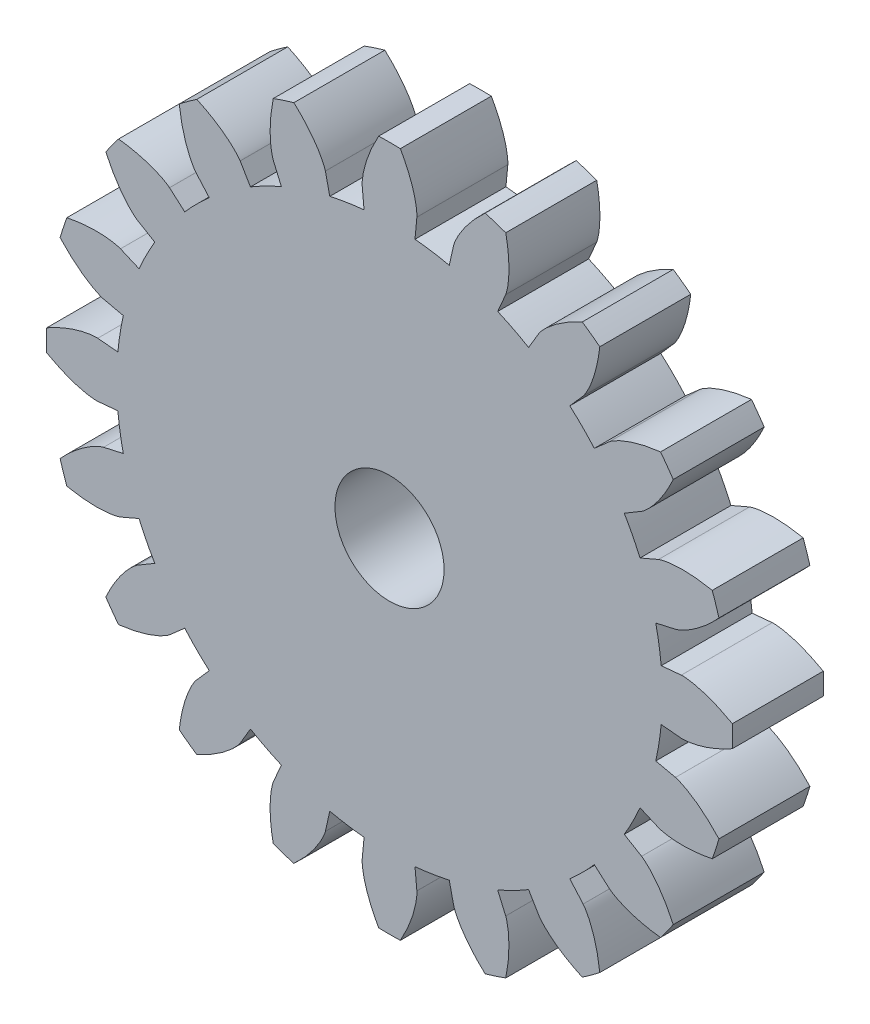
from build123d import *

# Parameters (mm, degrees)
BOSS_EXTRU_2_DEPTH      = 5
ESQUISSE5_R             = 3
ENL_V_MAT_EXTRU_1_DEPTH = 10


with BuildPart() as part:
    # Esquisse1 → Boss.-Extru.2 (new body)
    with BuildSketch(Plane.XY):
        with BuildLine():
            Line((15.061833018, -1.986598839), (16.166011031, -2.090079236))
            Line((16.166011031, -2.090079236), (16.167248729, -2.090184901))
            add(Edge.make_bspline(
                [(16.167248729, -2.090184901), (16.168010276, -2.090249591), (16.16950691, -2.090364207), (16.172217338, -2.090553644), (16.178108132, -2.090926243), (16.187803431, -2.091391834), (16.199588241, -2.091824401), (16.216075089, -2.092197747), (16.238348708, -2.092357298), (16.264570049, -2.09214555), (16.297766888, -2.091321508), (16.338641823, -2.089563323), (16.387967798, -2.086519176), (16.44653889, -2.081697831), (16.515028916, -2.074614628), (16.596049791, -2.064386014), (16.688524926, -2.05049604), (16.792857716, -2.032230542), (16.909645655, -2.008748342), (17.039170881, -1.979218799), (17.181775487, -1.942793825), (17.337755344, -1.898425888), (17.507314461, -1.845165066), (17.690589139, -1.781851971), (17.887635249, -1.707448887), (18.10712261, -1.617253369), (18.313769022, -1.524760348), (18.502569592, -1.434047819), (18.672140134, -1.347703339), (18.805881791, -1.276374918), (18.88088835, -1.235285986), (18.93417944, -1.205541045), (18.965584627, -1.187822628), (18.975011328, -1.182487176)],
                knots=[0, 0, 0, 0, 0, 0, 0.016666667, 0.025, 0.033333333, 0.054166667, 0.066666667, 0.083333333, 0.104166667, 0.125, 0.15, 0.175, 0.204166667, 0.2375, 0.270833333, 0.308333333, 0.35, 0.391666667, 0.4375, 0.483333333, 0.533333333, 0.5875, 0.641666667, 0.7, 0.758333333, 0.820833333, 0.9, 0.929166667, 0.958333333, 0.9875, 1, 1, 1, 1, 1, 1], degree=5, weights=[1, 1, 1, 1, 1, 1, 1, 1, 1, 1, 1, 1, 1, 1, 1, 1, 1, 1, 1, 1, 1, 1, 1, 1, 1, 1, 1, 1, 1, 1, 1, 1, 1, 1]))
            ThreePointArc((18.975011328, -1.182487176), (18.984416875, -0.58697479), (18.975011328, 0.008537596))
            add(Edge.make_bspline(
                [(18.975011328, 0.008537596), (18.915308885, 0.04232879), (18.837024614, 0.085739213), (18.734147438, 0.141213329), (18.594872445, 0.213559753), (18.423447438, 0.297985253), (18.278042022, 0.366393905), (18.113606417, 0.439634655), (17.937293773, 0.513256644), (17.761576686, 0.581605269), (17.581647157, 0.64623739), (17.396064457, 0.706993037), (17.21186886, 0.761159393), (17.030683095, 0.80807461), (16.833258221, 0.851875904), (16.649127604, 0.884407781), (16.493857536, 0.904487194), (16.36422671, 0.915220787), (16.275539883, 0.918408583), (16.228486641, 0.918530553), (16.201487473, 0.917959405), (16.185304316, 0.917327269), (16.177142959, 0.916919138), (16.17214071, 0.916599752), (16.169227945, 0.916394059), (16.167819889, 0.916283838), (16.167248729, 0.916235321)],
                knots=[-1, -1, -1, -1, -1, -1, -0.920833333, -0.895833333, -0.8625, -0.8125, -0.766666667, -0.720833333, -0.666666667, -0.6125, -0.558333333, -0.5, -0.4375, -0.375, -0.3125, -0.2125, -0.15, -0.108333333, -0.058333333, -0.045833333, -0.0375, -0.025, -0.0125, 0, 0, 0, 0, 0, 0], degree=5, weights=[1, 1, 1, 1, 1, 1, 1, 1, 1, 1, 1, 1, 1, 1, 1, 1, 1, 1, 1, 1, 1, 1, 1, 1, 1, 1, 1]))
            Line((16.167248729, 0.916235321), (16.166011031, 0.916129657))
            Line((16.166011031, 0.916129657), (15.061833018, 0.812649259))
            ThreePointArc((15.061833018, 0.812649259), (14.942599127, 1.759542186), (14.763391289, 2.696936172))
            Line((14.763391289, 2.696936172), (15.845504186, 2.939730237))
            Line((15.845504186, 2.939730237), (15.846713959, 2.940012214))
            add(Edge.make_bspline(
                [(15.846713959, 2.940012214), (15.847458223, 2.940186021), (15.848917025, 2.9405395), (15.851553334, 2.941196903), (15.857270952, 2.942662896), (15.866635605, 2.945216104), (15.877977295, 2.948446415), (15.89377259, 2.953186059), (15.915005364, 2.959917243), (15.939877908, 2.968221467), (15.971195335, 2.979263566), (16.009526399, 2.993566748), (16.055497496, 3.011704469), (16.109712037, 3.034389303), (16.172661093, 3.062290412), (16.246555708, 3.097055229), (16.33021255, 3.138841767), (16.423794581, 3.188453893), (16.527610112, 3.246876251), (16.641670792, 3.31498601), (16.766039895, 3.393695466), (16.900675109, 3.484092309), (17.045476912, 3.587143009), (17.200216667, 3.703992331), (17.364626837, 3.835644465), (17.545499774, 3.989250825), (17.713450274, 4.141074169), (17.864978574, 4.285689495), (17.999567832, 4.420208154), (18.104722011, 4.529373959), (18.16336031, 4.591630157), (18.204851456, 4.63638713), (18.229244271, 4.662943082), (18.236560852, 4.670930409)],
                knots=[0, 0, 0, 0, 0, 0, 0.016666667, 0.025, 0.033333333, 0.054166667, 0.066666667, 0.083333333, 0.104166667, 0.125, 0.15, 0.175, 0.204166667, 0.2375, 0.270833333, 0.308333333, 0.35, 0.391666667, 0.4375, 0.483333333, 0.533333333, 0.5875, 0.641666667, 0.7, 0.758333333, 0.820833333, 0.9, 0.929166667, 0.958333333, 0.9875, 1, 1, 1, 1, 1, 1], degree=5, weights=[1, 1, 1, 1, 1, 1, 1, 1, 1, 1, 1, 1, 1, 1, 1, 1, 1, 1, 1, 1, 1, 1, 1, 1, 1, 1, 1, 1, 1, 1, 1, 1, 1, 1]))
            ThreePointArc((18.236560852, 4.670930409), (18.061482611, 5.240202818), (17.868513957, 5.80366228))
            add(Edge.make_bspline(
                [(17.868513957, 5.80366228), (17.801291506, 5.817350545), (17.713424181, 5.83444514), (17.598439728, 5.855413365), (17.443625064, 5.881180563), (17.25450128, 5.908500745), (17.095073076, 5.928628494), (16.916052885, 5.94747119), (16.72561915, 5.963006259), (16.537381384, 5.973710098), (16.346285809, 5.979577616), (16.151011645, 5.980011462), (15.959092897, 5.974607158), (15.772277395, 5.9632367), (15.570979838, 5.943886565), (15.385808313, 5.917926729), (15.231932823, 5.889042296), (15.105329718, 5.859192421), (15.01999845, 5.834818459), (14.975210468, 5.820394208), (14.949709227, 5.811507812), (14.934513471, 5.805905744), (14.926877679, 5.802995591), (14.922218953, 5.801146056), (14.919512311, 5.800050337), (14.918207231, 5.799510397), (14.917679018, 5.799287757)],
                knots=[-1, -1, -1, -1, -1, -1, -0.920833333, -0.895833333, -0.8625, -0.8125, -0.766666667, -0.720833333, -0.666666667, -0.6125, -0.558333333, -0.5, -0.4375, -0.375, -0.3125, -0.2125, -0.15, -0.108333333, -0.058333333, -0.045833333, -0.0375, -0.025, -0.0125, 0, 0, 0, 0, 0, 0], degree=5, weights=[1, 1, 1, 1, 1, 1, 1, 1, 1, 1, 1, 1, 1, 1, 1, 1, 1, 1, 1, 1, 1, 1, 1, 1, 1, 1, 1]))
            Line((14.917679018, 5.799287757), (14.916534549, 5.798804794))
            Line((14.916534549, 5.798804794), (13.898376056, 5.359179317))
            ThreePointArc((13.898376056, 5.359179317), (13.492371881, 6.222882706), (13.032264427, 7.059019098))
            Line((13.032264427, 7.059019098), (13.986387456, 7.624321251))
            Line((13.986387456, 7.624321251), (13.987450883, 7.624963267))
            add(Edge.make_bspline(
                [(13.987450883, 7.624963267), (13.988105011, 7.625358558), (13.989383183, 7.626145531), (13.991687314, 7.627585422), (13.996672075, 7.630746506), (14.004789403, 7.636068588), (14.014577771, 7.642645571), (14.028135359, 7.652034254), (14.046248877, 7.664997279), (14.067337926, 7.680581105), (14.093710372, 7.700760382), (14.125745454, 7.726208467), (14.163861701, 7.757664314), (14.208412795, 7.795992088), (14.259658988, 7.841979947), (14.319194024, 7.897877945), (14.385843658, 7.963470691), (14.459514468, 8.039573064), (14.540195404, 8.127216792), (14.627626484, 8.227239711), (14.721585971, 8.340529018), (14.821697507, 8.468106093), (14.927567788, 8.610859351), (15.038625614, 8.769806874), (15.15430623, 8.945821031), (15.27885964, 9.147802172), (15.391674065, 9.344094311), (15.491097448, 9.528456479), (15.577530887, 9.697981694), (15.643804366, 9.834298973), (15.680334478, 9.911628367), (15.705964238, 9.967016246), (15.720956944, 9.999810253), (15.725447206, 10.0096676)],
                knots=[0, 0, 0, 0, 0, 0, 0.016666667, 0.025, 0.033333333, 0.054166667, 0.066666667, 0.083333333, 0.104166667, 0.125, 0.15, 0.175, 0.204166667, 0.2375, 0.270833333, 0.308333333, 0.35, 0.391666667, 0.4375, 0.483333333, 0.533333333, 0.5875, 0.641666667, 0.7, 0.758333333, 0.820833333, 0.9, 0.929166667, 0.958333333, 0.9875, 1, 1, 1, 1, 1, 1], degree=5, weights=[1, 1, 1, 1, 1, 1, 1, 1, 1, 1, 1, 1, 1, 1, 1, 1, 1, 1, 1, 1, 1, 1, 1, 1, 1, 1, 1, 1, 1, 1, 1, 1, 1, 1]))
            ThreePointArc((15.725447206, 10.0096676), (15.383023054, 10.496975682), (15.02538041, 10.973226881))
            add(Edge.make_bspline(
                [(15.02538041, 10.973226881), (14.957218153, 10.965472315), (14.868368841, 10.954577745), (14.75253259, 10.938987561), (14.597332593, 10.915653261), (14.409022785, 10.883193834), (14.251177736, 10.853070437), (14.075096704, 10.815670625), (13.889182858, 10.771598093), (13.706850436, 10.72360938), (13.523294581, 10.670137941), (13.33744375, 10.610207517), (13.156588196, 10.545761565), (12.98242976, 10.477218452), (12.796963927, 10.396611014), (12.628877372, 10.314700594), (12.491458866, 10.239679724), (12.380276276, 10.172168295), (12.306653387, 10.122618468), (12.268514822, 10.095059942), (12.247007749, 10.078728161), (12.23428686, 10.068704531), (12.227924077, 10.063577221), (12.224064903, 10.060378583), (12.221829329, 10.058500094), (12.220754975, 10.057583289), (12.220321415, 10.057208318)],
                knots=[-1, -1, -1, -1, -1, -1, -0.920833333, -0.895833333, -0.8625, -0.8125, -0.766666667, -0.720833333, -0.666666667, -0.6125, -0.558333333, -0.5, -0.4375, -0.375, -0.3125, -0.2125, -0.15, -0.108333333, -0.058333333, -0.045833333, -0.0375, -0.025, -0.0125, 0, 0, 0, 0, 0, 0], degree=5, weights=[1, 1, 1, 1, 1, 1, 1, 1, 1, 1, 1, 1, 1, 1, 1, 1, 1, 1, 1, 1, 1, 1, 1, 1, 1, 1, 1]))
            Line((12.220321415, 10.057208318), (12.219382204, 10.056395334))
            Line((12.219382204, 10.056395334), (11.386907677, 9.323658381))
            ThreePointArc((11.386907677, 9.323658381), (10.733875736, 10.019626928), (10.037907189, 10.67265887))
            Line((10.037907189, 10.67265887), (10.770644141, 11.505133396))
            Line((10.770644141, 11.505133396), (10.771457126, 11.506072607))
            add(Edge.make_bspline(
                [(10.771457126, 11.506072607), (10.771957087, 11.506650687), (10.772929513, 11.50779412), (10.774675921, 11.509875553), (10.778439882, 11.514422299), (10.784515306, 11.521992292), (10.791792197, 11.531272147), (10.801784967, 11.54439084), (10.815006151, 11.562316795), (10.830247362, 11.583654768), (10.849093309, 11.610995935), (10.871696592, 11.645097887), (10.898226906, 11.686792743), (10.92875358, 11.737011667), (10.963280576, 11.796584665), (11.002628329, 11.868144158), (11.045746624, 11.951122436), (11.092294802, 12.046265627), (11.14194353, 12.154551545), (11.194186646, 12.276696683), (11.248539107, 12.413476296), (11.304327352, 12.56574547), (11.36090279, 12.734227603), (11.417407573, 12.919714436), (11.473035012, 13.122861123), (11.529076738, 13.353445723), (11.575712025, 13.574992216), (11.613298239, 13.781054572), (11.643115151, 13.968992034), (11.66402062, 14.119117101), (11.674866725, 14.203950151), (11.682126279, 14.264547186), (11.686251284, 14.30036914), (11.687475689, 14.311131602)],
                knots=[0, 0, 0, 0, 0, 0, 0.016666667, 0.025, 0.033333333, 0.054166667, 0.066666667, 0.083333333, 0.104166667, 0.125, 0.15, 0.175, 0.204166667, 0.2375, 0.270833333, 0.308333333, 0.35, 0.391666667, 0.4375, 0.483333333, 0.533333333, 0.5875, 0.641666667, 0.7, 0.758333333, 0.820833333, 0.9, 0.929166667, 0.958333333, 0.9875, 1, 1, 1, 1, 1, 1], degree=5, weights=[1, 1, 1, 1, 1, 1, 1, 1, 1, 1, 1, 1, 1, 1, 1, 1, 1, 1, 1, 1, 1, 1, 1, 1, 1, 1, 1, 1, 1, 1, 1, 1, 1, 1]))
            ThreePointArc((11.687475689, 14.311131602), (11.21122449, 14.668774247), (10.723916407, 15.011198398))
            add(Edge.make_bspline(
                [(10.723916407, 15.011198398), (10.661486541, 14.982760072), (10.580352432, 14.944942772), (10.475003242, 14.894320256), (10.334609969, 14.824168582), (10.165547213, 14.735106902), (10.024736293, 14.657681045), (9.868830457, 14.567699679), (9.705635045, 14.468333673), (9.547055934, 14.366349878), (9.389007526, 14.258773639), (9.230772401, 14.144345353), (9.078683443, 14.02716617), (8.934229914, 13.90815988), (8.782750493, 13.774185556), (8.648202391, 13.644342516), (8.540692349, 13.530528775), (8.455813602, 13.431964281), (8.401105811, 13.362088871), (8.373349934, 13.324093691), (8.35794229, 13.301915192), (8.348941477, 13.288451183), (8.344474537, 13.281608613), (8.341792678, 13.277373978), (8.340247006, 13.274896598), (8.339508543, 13.273692671), (8.339212075, 13.273202075)],
                knots=[-1, -1, -1, -1, -1, -1, -0.920833333, -0.895833333, -0.8625, -0.8125, -0.766666667, -0.720833333, -0.666666667, -0.6125, -0.558333333, -0.5, -0.4375, -0.375, -0.3125, -0.2125, -0.15, -0.108333333, -0.058333333, -0.045833333, -0.0375, -0.025, -0.0125, 0, 0, 0, 0, 0, 0], degree=5, weights=[1, 1, 1, 1, 1, 1, 1, 1, 1, 1, 1, 1, 1, 1, 1, 1, 1, 1, 1, 1, 1, 1, 1, 1, 1, 1, 1]))
            Line((8.339212075, 13.273202075), (8.338570058, 13.272138649))
            Line((8.338570058, 13.272138649), (7.773267906, 12.318015619))
            ThreePointArc((7.773267906, 12.318015619), (6.937131514, 12.778123073), (6.073428124, 13.184127248))
            Line((6.073428124, 13.184127248), (6.513053602, 14.202285742))
            Line((6.513053602, 14.202285742), (6.513536564, 14.203430211))
            add(Edge.make_bspline(
                [(6.513536564, 14.203430211), (6.513833419, 14.204134494), (6.51440491, 14.205522459), (6.515422645, 14.20804169), (6.517597363, 14.213529029), (6.521036178, 14.22260593), (6.52508928, 14.23368028), (6.53053907, 14.249244834), (6.537573738, 14.270379), (6.545475194, 14.295382412), (6.554949871, 14.327209125), (6.565908787, 14.366626807), (6.578256196, 14.41447929), (6.591770287, 14.471673586), (6.606198343, 14.539000303), (6.62150718, 14.619216549), (6.636873418, 14.711457867), (6.651742503, 14.816328596), (6.665499061, 14.934656925), (6.677440293, 15.066967866), (6.686865331, 15.213848841), (6.692869342, 15.375904948), (6.694611939, 15.55362375), (6.691032597, 15.747493149), (6.681161656, 15.957886953), (6.663205945, 16.194503786), (6.639097108, 16.419618118), (6.611166951, 16.627209843), (6.58144865, 16.815162924), (6.554939735, 16.964400492), (6.53904014, 17.048433148), (6.527218872, 17.108307679), (6.520072392, 17.143651078), (6.517911087, 17.154265149)],
                knots=[0, 0, 0, 0, 0, 0, 0.016666667, 0.025, 0.033333333, 0.054166667, 0.066666667, 0.083333333, 0.104166667, 0.125, 0.15, 0.175, 0.204166667, 0.2375, 0.270833333, 0.308333333, 0.35, 0.391666667, 0.4375, 0.483333333, 0.533333333, 0.5875, 0.641666667, 0.7, 0.758333333, 0.820833333, 0.9, 0.929166667, 0.958333333, 0.9875, 1, 1, 1, 1, 1, 1], degree=5, weights=[1, 1, 1, 1, 1, 1, 1, 1, 1, 1, 1, 1, 1, 1, 1, 1, 1, 1, 1, 1, 1, 1, 1, 1, 1, 1, 1, 1, 1, 1, 1, 1, 1, 1]))
            ThreePointArc((6.517911087, 17.154265149), (5.954451626, 17.347233803), (5.385179217, 17.522312044))
            add(Edge.make_bspline(
                [(5.385179217, 17.522312044), (5.334592812, 17.4759737), (5.269115877, 17.414935492), (5.184566061, 17.334235928), (5.072722184, 17.224133813), (4.939455521, 17.087187858), (4.829462283, 16.970038525), (4.708992793, 16.836283608), (4.584490517, 16.691350764), (4.465187547, 16.545354771), (4.348117464, 16.394204044), (4.232987202, 16.236478934), (4.124552366, 16.078036836), (4.023943863, 15.920216533), (3.921278716, 15.745989664), (3.833439572, 15.580923945), (3.766361826, 15.439458214), (3.716095444, 15.319488835), (3.685657933, 15.236127734), (3.671001682, 15.191415132), (3.663201674, 15.165560903), (3.658802, 15.149974465), (3.656668158, 15.142086434), (3.655426133, 15.137230316), (3.654721664, 15.134396549), (3.654391377, 15.133023349), (3.654261022, 15.132465151)],
                knots=[-1, -1, -1, -1, -1, -1, -0.920833333, -0.895833333, -0.8625, -0.8125, -0.766666667, -0.720833333, -0.666666667, -0.6125, -0.558333333, -0.5, -0.4375, -0.375, -0.3125, -0.2125, -0.15, -0.108333333, -0.058333333, -0.045833333, -0.0375, -0.025, -0.0125, 0, 0, 0, 0, 0, 0], degree=5, weights=[1, 1, 1, 1, 1, 1, 1, 1, 1, 1, 1, 1, 1, 1, 1, 1, 1, 1, 1, 1, 1, 1, 1, 1, 1, 1, 1]))
            Line((3.654261022, 15.132465151), (3.653979045, 15.131255378))
            Line((3.653979045, 15.131255378), (3.41118498, 14.049142482))
            ThreePointArc((3.41118498, 14.049142482), (2.473790993, 14.228350319), (1.526898067, 14.34758421))
            Line((1.526898067, 14.34758421), (1.630378464, 15.451762224))
            Line((1.630378464, 15.451762224), (1.630484128, 15.452999922))
            add(Edge.make_bspline(
                [(1.630484128, 15.452999922), (1.630548818, 15.453761468), (1.630663434, 15.455258102), (1.630852872, 15.45796853), (1.631225471, 15.463859325), (1.631691062, 15.473554623), (1.632123629, 15.485339433), (1.632496975, 15.501826281), (1.632656526, 15.5240999), (1.632444778, 15.550321242), (1.631620735, 15.583518081), (1.629862551, 15.624393015), (1.626818404, 15.67371899), (1.621997059, 15.732290082), (1.614913856, 15.800780109), (1.604685242, 15.881800984), (1.590795268, 15.974276119), (1.57252977, 16.078608909), (1.549047569, 16.195396848), (1.519518027, 16.324922073), (1.483093053, 16.467526679), (1.438725116, 16.623506537), (1.385464294, 16.793065653), (1.322151199, 16.976340331), (1.247748115, 17.173386442), (1.157552597, 17.392873803), (1.065059575, 17.599520214), (0.974347047, 17.788320784), (0.888002567, 17.957891327), (0.816674146, 18.091632983), (0.775585214, 18.166639542), (0.745840273, 18.219930633), (0.728121855, 18.251335819), (0.722786404, 18.260762521)],
                knots=[0, 0, 0, 0, 0, 0, 0.016666667, 0.025, 0.033333333, 0.054166667, 0.066666667, 0.083333333, 0.104166667, 0.125, 0.15, 0.175, 0.204166667, 0.2375, 0.270833333, 0.308333333, 0.35, 0.391666667, 0.4375, 0.483333333, 0.533333333, 0.5875, 0.641666667, 0.7, 0.758333333, 0.820833333, 0.9, 0.929166667, 0.958333333, 0.9875, 1, 1, 1, 1, 1, 1], degree=5, weights=[1, 1, 1, 1, 1, 1, 1, 1, 1, 1, 1, 1, 1, 1, 1, 1, 1, 1, 1, 1, 1, 1, 1, 1, 1, 1, 1, 1, 1, 1, 1, 1, 1, 1]))
            ThreePointArc((0.722786404, 18.260762521), (0.127274018, 18.270168067), (-0.468238368, 18.260762521))
            add(Edge.make_bspline(
                [(-0.468238368, 18.260762521), (-0.502029562, 18.201060077), (-0.545439985, 18.122775806), (-0.600914101, 18.01989863), (-0.673260525, 17.880623638), (-0.757686026, 17.70919863), (-0.826094677, 17.563793215), (-0.899335427, 17.39935761), (-0.972957416, 17.223044965), (-1.041306041, 17.047327879), (-1.105938162, 16.86739835), (-1.166693809, 16.681815649), (-1.220860165, 16.497620052), (-1.267775382, 16.316434287), (-1.311576676, 16.119009413), (-1.344108554, 15.934878797), (-1.364187966, 15.779608728), (-1.374921559, 15.649977902), (-1.378109356, 15.561291075), (-1.378231325, 15.514237834), (-1.377660177, 15.487238666), (-1.377028041, 15.471055508), (-1.376619911, 15.462894152), (-1.376300524, 15.457891902), (-1.376094831, 15.454979137), (-1.37598461, 15.453571082), (-1.375936093, 15.452999922)],
                knots=[-1, -1, -1, -1, -1, -1, -0.920833333, -0.895833333, -0.8625, -0.8125, -0.766666667, -0.720833333, -0.666666667, -0.6125, -0.558333333, -0.5, -0.4375, -0.375, -0.3125, -0.2125, -0.15, -0.108333333, -0.058333333, -0.045833333, -0.0375, -0.025, -0.0125, 0, 0, 0, 0, 0, 0], degree=5, weights=[1, 1, 1, 1, 1, 1, 1, 1, 1, 1, 1, 1, 1, 1, 1, 1, 1, 1, 1, 1, 1, 1, 1, 1, 1, 1, 1]))
            Line((-1.375936093, 15.452999922), (-1.375830429, 15.451762224))
            Line((-1.375830429, 15.451762224), (-1.272350031, 14.34758421))
            ThreePointArc((-1.272350031, 14.34758421), (-2.219242958, 14.228350319), (-3.156636945, 14.049142482))
            Line((-3.156636945, 14.049142482), (-3.399431009, 15.131255378))
            Line((-3.399431009, 15.131255378), (-3.399712986, 15.132465151))
            add(Edge.make_bspline(
                [(-3.399712986, 15.132465151), (-3.399886793, 15.133209415), (-3.400240272, 15.134668217), (-3.400897675, 15.137304526), (-3.402363668, 15.143022145), (-3.404916877, 15.152386797), (-3.408147188, 15.163728488), (-3.412886831, 15.179523782), (-3.419618015, 15.200756556), (-3.42792224, 15.225629101), (-3.438964338, 15.256946527), (-3.45326752, 15.295277592), (-3.471405241, 15.341248688), (-3.494090075, 15.395463229), (-3.521991184, 15.458412285), (-3.556756001, 15.532306901), (-3.59854254, 15.615963743), (-3.648154665, 15.709545773), (-3.706577023, 15.813361305), (-3.774686783, 15.927421984), (-3.853396239, 16.051791088), (-3.943793081, 16.186426301), (-4.046843781, 16.331228105), (-4.163693103, 16.485967859), (-4.295345237, 16.650378029), (-4.448951597, 16.831250966), (-4.600774941, 16.999201466), (-4.745390267, 17.150729766), (-4.879908927, 17.285319024), (-4.989074731, 17.390473204), (-5.051330929, 17.449111502), (-5.096087902, 17.490602649), (-5.122643855, 17.514995464), (-5.130631182, 17.522312044)],
                knots=[0, 0, 0, 0, 0, 0, 0.016666667, 0.025, 0.033333333, 0.054166667, 0.066666667, 0.083333333, 0.104166667, 0.125, 0.15, 0.175, 0.204166667, 0.2375, 0.270833333, 0.308333333, 0.35, 0.391666667, 0.4375, 0.483333333, 0.533333333, 0.5875, 0.641666667, 0.7, 0.758333333, 0.820833333, 0.9, 0.929166667, 0.958333333, 0.9875, 1, 1, 1, 1, 1, 1], degree=5, weights=[1, 1, 1, 1, 1, 1, 1, 1, 1, 1, 1, 1, 1, 1, 1, 1, 1, 1, 1, 1, 1, 1, 1, 1, 1, 1, 1, 1, 1, 1, 1, 1, 1, 1]))
            ThreePointArc((-5.130631182, 17.522312044), (-5.69990359, 17.347233803), (-6.263363052, 17.154265149))
            add(Edge.make_bspline(
                [(-6.263363052, 17.154265149), (-6.277051318, 17.087042698), (-6.294145913, 16.999175373), (-6.315114137, 16.88419092), (-6.340881335, 16.729376257), (-6.368201517, 16.540252472), (-6.388329266, 16.380824268), (-6.407171963, 16.201804078), (-6.422707031, 16.011370342), (-6.433410871, 15.823132576), (-6.439278388, 15.632037001), (-6.439712234, 15.436762837), (-6.43430793, 15.24484409), (-6.422937472, 15.058028588), (-6.403587337, 14.856731031), (-6.377627502, 14.671559505), (-6.348743068, 14.517684015), (-6.318893193, 14.39108091), (-6.294519231, 14.305749643), (-6.28009498, 14.26096166), (-6.271208584, 14.23546042), (-6.265606516, 14.220264663), (-6.262696363, 14.212628871), (-6.260846828, 14.207970145), (-6.259751109, 14.205263503), (-6.25921117, 14.203958423), (-6.258988529, 14.203430211)],
                knots=[-1, -1, -1, -1, -1, -1, -0.920833333, -0.895833333, -0.8625, -0.8125, -0.766666667, -0.720833333, -0.666666667, -0.6125, -0.558333333, -0.5, -0.4375, -0.375, -0.3125, -0.2125, -0.15, -0.108333333, -0.058333333, -0.045833333, -0.0375, -0.025, -0.0125, 0, 0, 0, 0, 0, 0], degree=5, weights=[1, 1, 1, 1, 1, 1, 1, 1, 1, 1, 1, 1, 1, 1, 1, 1, 1, 1, 1, 1, 1, 1, 1, 1, 1, 1, 1]))
            Line((-6.258988529, 14.203430211), (-6.258505566, 14.202285742))
            Line((-6.258505566, 14.202285742), (-5.818880089, 13.184127248))
            ThreePointArc((-5.818880089, 13.184127248), (-6.682583478, 12.778123073), (-7.518719871, 12.318015619))
            Line((-7.518719871, 12.318015619), (-8.084022023, 13.272138649))
            Line((-8.084022023, 13.272138649), (-8.084664039, 13.273202075))
            add(Edge.make_bspline(
                [(-8.084664039, 13.273202075), (-8.08505933, 13.273856203), (-8.085846303, 13.275134375), (-8.087286194, 13.277438506), (-8.090447278, 13.282423267), (-8.09576936, 13.290540596), (-8.102346344, 13.300328964), (-8.111735027, 13.313886551), (-8.124698052, 13.332000069), (-8.140281877, 13.353089118), (-8.160461154, 13.379461565), (-8.185909239, 13.411496647), (-8.217365086, 13.449612894), (-8.25569286, 13.494163987), (-8.301680719, 13.54541018), (-8.357578717, 13.604945216), (-8.423171463, 13.671594851), (-8.499273836, 13.745265661), (-8.586917564, 13.825946597), (-8.686940483, 13.913377676), (-8.80022979, 14.007337163), (-8.927806865, 14.107448699), (-9.070560123, 14.213318981), (-9.229507646, 14.324376806), (-9.405521803, 14.440057423), (-9.607502944, 14.564610832), (-9.803795083, 14.677425257), (-9.988157251, 14.776848641), (-10.157682467, 14.863282079), (-10.293999745, 14.929555558), (-10.371329139, 14.966085671), (-10.426717018, 14.991715431), (-10.459511025, 15.006708136), (-10.469368372, 15.011198398)],
                knots=[0, 0, 0, 0, 0, 0, 0.016666667, 0.025, 0.033333333, 0.054166667, 0.066666667, 0.083333333, 0.104166667, 0.125, 0.15, 0.175, 0.204166667, 0.2375, 0.270833333, 0.308333333, 0.35, 0.391666667, 0.4375, 0.483333333, 0.533333333, 0.5875, 0.641666667, 0.7, 0.758333333, 0.820833333, 0.9, 0.929166667, 0.958333333, 0.9875, 1, 1, 1, 1, 1, 1], degree=5, weights=[1, 1, 1, 1, 1, 1, 1, 1, 1, 1, 1, 1, 1, 1, 1, 1, 1, 1, 1, 1, 1, 1, 1, 1, 1, 1, 1, 1, 1, 1, 1, 1, 1, 1]))
            ThreePointArc((-10.469368372, 15.011198398), (-10.956676454, 14.668774247), (-11.432927653, 14.311131602))
            add(Edge.make_bspline(
                [(-11.432927653, 14.311131602), (-11.425173088, 14.242969345), (-11.414278517, 14.154120033), (-11.398688333, 14.038283782), (-11.375354033, 13.883083785), (-11.342894607, 13.694773977), (-11.312771209, 13.536928928), (-11.275371397, 13.360847896), (-11.231298865, 13.174934051), (-11.183310152, 12.992601628), (-11.129838713, 12.809045774), (-11.069908289, 12.623194942), (-11.005462337, 12.442339389), (-10.936919224, 12.268180953), (-10.856311786, 12.08271512), (-10.774401366, 11.914628564), (-10.699380496, 11.777210058), (-10.631869067, 11.666027469), (-10.58231924, 11.592404579), (-10.554760714, 11.554266015), (-10.538428933, 11.532758941), (-10.528405303, 11.520038052), (-10.523277993, 11.513675269), (-10.520079355, 11.509816095), (-10.518200866, 11.507580522), (-10.517284061, 11.506506167), (-10.516909091, 11.506072607)],
                knots=[-1, -1, -1, -1, -1, -1, -0.920833333, -0.895833333, -0.8625, -0.8125, -0.766666667, -0.720833333, -0.666666667, -0.6125, -0.558333333, -0.5, -0.4375, -0.375, -0.3125, -0.2125, -0.15, -0.108333333, -0.058333333, -0.045833333, -0.0375, -0.025, -0.0125, 0, 0, 0, 0, 0, 0], degree=5, weights=[1, 1, 1, 1, 1, 1, 1, 1, 1, 1, 1, 1, 1, 1, 1, 1, 1, 1, 1, 1, 1, 1, 1, 1, 1, 1, 1]))
            Line((-10.516909091, 11.506072607), (-10.516096106, 11.505133396))
            Line((-10.516096106, 11.505133396), (-9.783359153, 10.67265887))
            ThreePointArc((-9.783359153, 10.67265887), (-10.4793277, 10.019626928), (-11.132359642, 9.323658381))
            Line((-11.132359642, 9.323658381), (-11.964834168, 10.056395334))
            Line((-11.964834168, 10.056395334), (-11.965773379, 10.057208318))
            add(Edge.make_bspline(
                [(-11.965773379, 10.057208318), (-11.96635146, 10.057708279), (-11.967494892, 10.058680705), (-11.969576326, 10.060427113), (-11.974123071, 10.064191074), (-11.981693064, 10.070266499), (-11.990972919, 10.07754339), (-12.004091613, 10.087536159), (-12.022017567, 10.100757343), (-12.04335554, 10.115998554), (-12.070696707, 10.134844502), (-12.104798659, 10.157447784), (-12.146493515, 10.183978098), (-12.196712439, 10.214504772), (-12.256285437, 10.249031768), (-12.32784493, 10.288379521), (-12.410823208, 10.331497817), (-12.505966399, 10.378045994), (-12.614252317, 10.427694723), (-12.736397455, 10.479937839), (-12.873177068, 10.5342903), (-13.025446242, 10.590078545), (-13.193928375, 10.646653983), (-13.379415208, 10.703158765), (-13.582561895, 10.758786204), (-13.813146495, 10.814827931), (-14.034692988, 10.861463218), (-14.240755344, 10.899049431), (-14.428692807, 10.928866344), (-14.578817874, 10.949771812), (-14.663650923, 10.960617917), (-14.724247959, 10.967877471), (-14.760069913, 10.972002476), (-14.770832374, 10.973226881)],
                knots=[0, 0, 0, 0, 0, 0, 0.016666667, 0.025, 0.033333333, 0.054166667, 0.066666667, 0.083333333, 0.104166667, 0.125, 0.15, 0.175, 0.204166667, 0.2375, 0.270833333, 0.308333333, 0.35, 0.391666667, 0.4375, 0.483333333, 0.533333333, 0.5875, 0.641666667, 0.7, 0.758333333, 0.820833333, 0.9, 0.929166667, 0.958333333, 0.9875, 1, 1, 1, 1, 1, 1], degree=5, weights=[1, 1, 1, 1, 1, 1, 1, 1, 1, 1, 1, 1, 1, 1, 1, 1, 1, 1, 1, 1, 1, 1, 1, 1, 1, 1, 1, 1, 1, 1, 1, 1, 1, 1]))
            ThreePointArc((-14.770832374, 10.973226881), (-15.128475019, 10.496975682), (-15.47089917, 10.0096676))
            add(Edge.make_bspline(
                [(-15.47089917, 10.0096676), (-15.442460844, 9.947237734), (-15.404643545, 9.866103624), (-15.354021029, 9.760754434), (-15.283869354, 9.620361161), (-15.194807674, 9.451298406), (-15.117381818, 9.310487485), (-15.027400452, 9.15458165), (-14.928034445, 8.991386237), (-14.82605065, 8.832807126), (-14.718474411, 8.674758718), (-14.604046125, 8.516523593), (-14.486866943, 8.364434635), (-14.367860652, 8.219981106), (-14.233886329, 8.068501686), (-14.104043288, 7.933953583), (-13.990229547, 7.826443541), (-13.891665053, 7.741564794), (-13.821789643, 7.686857004), (-13.783794463, 7.659101127), (-13.761615965, 7.643693482), (-13.748151955, 7.63469267), (-13.741309386, 7.630225729), (-13.73707475, 7.62754387), (-13.73459737, 7.625998199), (-13.733393443, 7.625259735), (-13.732902848, 7.624963267)],
                knots=[-1, -1, -1, -1, -1, -1, -0.920833333, -0.895833333, -0.8625, -0.8125, -0.766666667, -0.720833333, -0.666666667, -0.6125, -0.558333333, -0.5, -0.4375, -0.375, -0.3125, -0.2125, -0.15, -0.108333333, -0.058333333, -0.045833333, -0.0375, -0.025, -0.0125, 0, 0, 0, 0, 0, 0], degree=5, weights=[1, 1, 1, 1, 1, 1, 1, 1, 1, 1, 1, 1, 1, 1, 1, 1, 1, 1, 1, 1, 1, 1, 1, 1, 1, 1, 1]))
            Line((-13.732902848, 7.624963267), (-13.731839421, 7.624321251))
            Line((-13.731839421, 7.624321251), (-12.777716391, 7.059019098))
            ThreePointArc((-12.777716391, 7.059019098), (-13.237823845, 6.222882706), (-13.64382802, 5.359179317))
            Line((-13.64382802, 5.359179317), (-14.661986514, 5.798804794))
            Line((-14.661986514, 5.798804794), (-14.663130983, 5.799287757))
            add(Edge.make_bspline(
                [(-14.663130983, 5.799287757), (-14.663835266, 5.799584611), (-14.665223231, 5.800156103), (-14.667742462, 5.801173837), (-14.673229801, 5.803348555), (-14.682306703, 5.80678737), (-14.693381052, 5.810840472), (-14.708945606, 5.816290262), (-14.730079773, 5.823324931), (-14.755083184, 5.831226387), (-14.786909897, 5.840701063), (-14.826327579, 5.85165998), (-14.874180062, 5.864007388), (-14.931374358, 5.87752148), (-14.998701075, 5.891949535), (-15.078917321, 5.907258373), (-15.171158639, 5.922624611), (-15.276029368, 5.937493695), (-15.394357698, 5.951250253), (-15.526668638, 5.963191485), (-15.673549614, 5.972616523), (-15.83560572, 5.978620534), (-16.013324522, 5.980363131), (-16.207193921, 5.976783789), (-16.417587726, 5.966912849), (-16.654204558, 5.948957138), (-16.87931889, 5.9248483), (-17.086910615, 5.896918144), (-17.274863696, 5.867199843), (-17.424101265, 5.840690928), (-17.50813392, 5.824791332), (-17.568008451, 5.812970065), (-17.60335185, 5.805823585), (-17.613965921, 5.80366228)],
                knots=[0, 0, 0, 0, 0, 0, 0.016666667, 0.025, 0.033333333, 0.054166667, 0.066666667, 0.083333333, 0.104166667, 0.125, 0.15, 0.175, 0.204166667, 0.2375, 0.270833333, 0.308333333, 0.35, 0.391666667, 0.4375, 0.483333333, 0.533333333, 0.5875, 0.641666667, 0.7, 0.758333333, 0.820833333, 0.9, 0.929166667, 0.958333333, 0.9875, 1, 1, 1, 1, 1, 1], degree=5, weights=[1, 1, 1, 1, 1, 1, 1, 1, 1, 1, 1, 1, 1, 1, 1, 1, 1, 1, 1, 1, 1, 1, 1, 1, 1, 1, 1, 1, 1, 1, 1, 1, 1, 1]))
            ThreePointArc((-17.613965921, 5.80366228), (-17.806934575, 5.240202818), (-17.982012817, 4.670930409))
            add(Edge.make_bspline(
                [(-17.982012817, 4.670930409), (-17.935674472, 4.620344005), (-17.874636264, 4.554867069), (-17.7939367, 4.470317254), (-17.683834586, 4.358473376), (-17.54688863, 4.225206713), (-17.429739297, 4.115213475), (-17.29598438, 3.994743986), (-17.151051536, 3.87024171), (-17.005055543, 3.750938739), (-16.853904816, 3.633868656), (-16.696179707, 3.518738394), (-16.537737608, 3.410303559), (-16.379917305, 3.309695055), (-16.205690437, 3.207029908), (-16.040624717, 3.119190764), (-15.899158986, 3.052113019), (-15.779189607, 3.001846637), (-15.695828506, 2.971409125), (-15.651115904, 2.956752874), (-15.625261675, 2.948952866), (-15.609675237, 2.944553193), (-15.601787207, 2.94241935), (-15.596931089, 2.941177325), (-15.594097322, 2.940472856), (-15.592724121, 2.940142569), (-15.592165923, 2.940012214)],
                knots=[-1, -1, -1, -1, -1, -1, -0.920833333, -0.895833333, -0.8625, -0.8125, -0.766666667, -0.720833333, -0.666666667, -0.6125, -0.558333333, -0.5, -0.4375, -0.375, -0.3125, -0.2125, -0.15, -0.108333333, -0.058333333, -0.045833333, -0.0375, -0.025, -0.0125, 0, 0, 0, 0, 0, 0], degree=5, weights=[1, 1, 1, 1, 1, 1, 1, 1, 1, 1, 1, 1, 1, 1, 1, 1, 1, 1, 1, 1, 1, 1, 1, 1, 1, 1, 1]))
            Line((-15.592165923, 2.940012214), (-15.590956151, 2.939730237))
            Line((-15.590956151, 2.939730237), (-14.508843254, 2.696936172))
            ThreePointArc((-14.508843254, 2.696936172), (-14.688051091, 1.759542186), (-14.807284982, 0.812649259))
            Line((-14.807284982, 0.812649259), (-15.911462996, 0.916129657))
            Line((-15.911462996, 0.916129657), (-15.912700694, 0.916235321))
            add(Edge.make_bspline(
                [(-15.912700694, 0.916235321), (-15.913462241, 0.916300011), (-15.914958874, 0.916414627), (-15.917669302, 0.916604064), (-15.923560097, 0.916976663), (-15.933255395, 0.917442254), (-15.945040205, 0.917874821), (-15.961527054, 0.918248167), (-15.983800672, 0.918407718), (-16.010022014, 0.91819597), (-16.043218853, 0.917371928), (-16.084093788, 0.915613743), (-16.133419762, 0.912569596), (-16.191990854, 0.907748251), (-16.260480881, 0.900665048), (-16.341501756, 0.890436434), (-16.433976891, 0.87654646), (-16.538309681, 0.858280963), (-16.65509762, 0.834798762), (-16.784622846, 0.80526922), (-16.927227452, 0.768844245), (-17.083207309, 0.724476308), (-17.252766426, 0.671215486), (-17.436041104, 0.607902391), (-17.633087214, 0.533499307), (-17.852574575, 0.443303789), (-18.059220986, 0.350810768), (-18.248021556, 0.26009824), (-18.417592099, 0.17375376), (-18.551333755, 0.102425339), (-18.626340315, 0.061336406), (-18.679631405, 0.031591465), (-18.711036591, 0.013873048), (-18.720463293, 0.008537596)],
                knots=[0, 0, 0, 0, 0, 0, 0.016666667, 0.025, 0.033333333, 0.054166667, 0.066666667, 0.083333333, 0.104166667, 0.125, 0.15, 0.175, 0.204166667, 0.2375, 0.270833333, 0.308333333, 0.35, 0.391666667, 0.4375, 0.483333333, 0.533333333, 0.5875, 0.641666667, 0.7, 0.758333333, 0.820833333, 0.9, 0.929166667, 0.958333333, 0.9875, 1, 1, 1, 1, 1, 1], degree=5, weights=[1, 1, 1, 1, 1, 1, 1, 1, 1, 1, 1, 1, 1, 1, 1, 1, 1, 1, 1, 1, 1, 1, 1, 1, 1, 1, 1, 1, 1, 1, 1, 1, 1, 1]))
            ThreePointArc((-18.720463293, 0.008537596), (-18.729868839, -0.58697479), (-18.720463293, -1.182487176))
            add(Edge.make_bspline(
                [(-18.720463293, -1.182487176), (-18.66076085, -1.21627837), (-18.582476578, -1.259688792), (-18.479599403, -1.315162909), (-18.34032441, -1.387509333), (-18.168899403, -1.471934833), (-18.023493987, -1.540343485), (-17.859058382, -1.613584235), (-17.682745737, -1.687206224), (-17.507028651, -1.755554849), (-17.327099122, -1.82018697), (-17.141516421, -1.880942617), (-16.957320825, -1.935108973), (-16.776135059, -1.98202419), (-16.578710185, -2.025825484), (-16.394579569, -2.058357361), (-16.239309501, -2.078436774), (-16.109678674, -2.089170367), (-16.020991848, -2.092358163), (-15.973938606, -2.092480133), (-15.946939438, -2.091908985), (-15.93075628, -2.091276849), (-15.922594924, -2.090868718), (-15.917592674, -2.090549331), (-15.914679909, -2.090343639), (-15.913271854, -2.090233418), (-15.912700694, -2.090184901)],
                knots=[-1, -1, -1, -1, -1, -1, -0.920833333, -0.895833333, -0.8625, -0.8125, -0.766666667, -0.720833333, -0.666666667, -0.6125, -0.558333333, -0.5, -0.4375, -0.375, -0.3125, -0.2125, -0.15, -0.108333333, -0.058333333, -0.045833333, -0.0375, -0.025, -0.0125, 0, 0, 0, 0, 0, 0], degree=5, weights=[1, 1, 1, 1, 1, 1, 1, 1, 1, 1, 1, 1, 1, 1, 1, 1, 1, 1, 1, 1, 1, 1, 1, 1, 1, 1, 1]))
            Line((-15.912700694, -2.090184901), (-15.911462996, -2.090079236))
            Line((-15.911462996, -2.090079236), (-14.807284982, -1.986598839))
            ThreePointArc((-14.807284982, -1.986598839), (-14.688051091, -2.933491766), (-14.508843254, -3.870885752))
            Line((-14.508843254, -3.870885752), (-15.590956151, -4.113679817))
            Line((-15.590956151, -4.113679817), (-15.592165923, -4.113961794))
            add(Edge.make_bspline(
                [(-15.592165923, -4.113961794), (-15.592910187, -4.114135601), (-15.594368989, -4.11448908), (-15.597005299, -4.115146482), (-15.602722917, -4.116612476), (-15.612087569, -4.119165684), (-15.62342926, -4.122395995), (-15.639224554, -4.127135638), (-15.660457329, -4.133866823), (-15.685329873, -4.142171047), (-15.7166473, -4.153213146), (-15.754978364, -4.167516328), (-15.80094946, -4.185654048), (-15.855164001, -4.208338883), (-15.918113058, -4.236239991), (-15.992007673, -4.271004809), (-16.075664515, -4.312791347), (-16.169246546, -4.362403473), (-16.273062077, -4.420825831), (-16.387122756, -4.48893559), (-16.51149186, -4.567645046), (-16.646127073, -4.658041888), (-16.790928877, -4.761092589), (-16.945668631, -4.877941911), (-17.110078801, -5.009594045), (-17.290951738, -5.163200405), (-17.458902239, -5.315023749), (-17.610430539, -5.459639074), (-17.745019796, -5.594157734), (-17.850173976, -5.703323539), (-17.908812274, -5.765579737), (-17.950303421, -5.81033671), (-17.974696236, -5.836892662), (-17.982012817, -5.844879989)],
                knots=[0, 0, 0, 0, 0, 0, 0.016666667, 0.025, 0.033333333, 0.054166667, 0.066666667, 0.083333333, 0.104166667, 0.125, 0.15, 0.175, 0.204166667, 0.2375, 0.270833333, 0.308333333, 0.35, 0.391666667, 0.4375, 0.483333333, 0.533333333, 0.5875, 0.641666667, 0.7, 0.758333333, 0.820833333, 0.9, 0.929166667, 0.958333333, 0.9875, 1, 1, 1, 1, 1, 1], degree=5, weights=[1, 1, 1, 1, 1, 1, 1, 1, 1, 1, 1, 1, 1, 1, 1, 1, 1, 1, 1, 1, 1, 1, 1, 1, 1, 1, 1, 1, 1, 1, 1, 1, 1, 1]))
            ThreePointArc((-17.982012817, -5.844879989), (-17.806934575, -6.414152398), (-17.613965921, -6.97761186))
            add(Edge.make_bspline(
                [(-17.613965921, -6.97761186), (-17.54674347, -6.991300125), (-17.458876146, -7.00839472), (-17.343891693, -7.029362945), (-17.189077029, -7.055130143), (-16.999953244, -7.082450325), (-16.84052504, -7.102578074), (-16.66150485, -7.12142077), (-16.471071115, -7.136955839), (-16.282833348, -7.147659678), (-16.091737773, -7.153527196), (-15.896463609, -7.153961042), (-15.704544862, -7.148556738), (-15.51772936, -7.13718628), (-15.316431803, -7.117836145), (-15.131260277, -7.091876309), (-14.977384787, -7.062991875), (-14.850781683, -7.033142001), (-14.765450415, -7.008768039), (-14.720662432, -6.994343788), (-14.695161192, -6.985457392), (-14.679965435, -6.979855324), (-14.672329643, -6.976945171), (-14.667670917, -6.975095636), (-14.664964275, -6.973999916), (-14.663659195, -6.973459977), (-14.663130983, -6.973237336)],
                knots=[-1, -1, -1, -1, -1, -1, -0.920833333, -0.895833333, -0.8625, -0.8125, -0.766666667, -0.720833333, -0.666666667, -0.6125, -0.558333333, -0.5, -0.4375, -0.375, -0.3125, -0.2125, -0.15, -0.108333333, -0.058333333, -0.045833333, -0.0375, -0.025, -0.0125, 0, 0, 0, 0, 0, 0], degree=5, weights=[1, 1, 1, 1, 1, 1, 1, 1, 1, 1, 1, 1, 1, 1, 1, 1, 1, 1, 1, 1, 1, 1, 1, 1, 1, 1, 1]))
            Line((-14.663130983, -6.973237336), (-14.661986514, -6.972754374))
            Line((-14.661986514, -6.972754374), (-13.64382802, -6.533128897))
            ThreePointArc((-13.64382802, -6.533128897), (-13.237823845, -7.396832286), (-12.777716391, -8.232968678))
            Line((-12.777716391, -8.232968678), (-13.731839421, -8.79827083))
            Line((-13.731839421, -8.79827083), (-13.732902848, -8.798912847))
            add(Edge.make_bspline(
                [(-13.732902848, -8.798912847), (-13.733556975, -8.799308138), (-13.734835147, -8.80009511), (-13.737139278, -8.801535002), (-13.742124039, -8.804696085), (-13.750241368, -8.810018168), (-13.760029736, -8.816595151), (-13.773587324, -8.825983834), (-13.791700841, -8.838946859), (-13.81278989, -8.854530685), (-13.839162337, -8.874709961), (-13.871197419, -8.900158046), (-13.909313666, -8.931613894), (-13.953864759, -8.969941668), (-14.005110953, -9.015929527), (-14.064645989, -9.071827525), (-14.131295623, -9.137420271), (-14.204966433, -9.213522644), (-14.285647369, -9.301166372), (-14.373078448, -9.40118929), (-14.467037935, -9.514478598), (-14.567149472, -9.642055673), (-14.673019753, -9.784808931), (-14.784077578, -9.943756454), (-14.899758195, -10.119770611), (-15.024311605, -10.321751752), (-15.137126029, -10.518043891), (-15.236549413, -10.702406059), (-15.322982851, -10.871931274), (-15.38925633, -11.008248552), (-15.425786443, -11.085577946), (-15.451416203, -11.140965826), (-15.466408908, -11.173759832), (-15.47089917, -11.18361718)],
                knots=[0, 0, 0, 0, 0, 0, 0.016666667, 0.025, 0.033333333, 0.054166667, 0.066666667, 0.083333333, 0.104166667, 0.125, 0.15, 0.175, 0.204166667, 0.2375, 0.270833333, 0.308333333, 0.35, 0.391666667, 0.4375, 0.483333333, 0.533333333, 0.5875, 0.641666667, 0.7, 0.758333333, 0.820833333, 0.9, 0.929166667, 0.958333333, 0.9875, 1, 1, 1, 1, 1, 1], degree=5, weights=[1, 1, 1, 1, 1, 1, 1, 1, 1, 1, 1, 1, 1, 1, 1, 1, 1, 1, 1, 1, 1, 1, 1, 1, 1, 1, 1, 1, 1, 1, 1, 1, 1, 1]))
            ThreePointArc((-15.47089917, -11.18361718), (-15.128475019, -11.670925262), (-14.770832374, -12.147176461))
            add(Edge.make_bspline(
                [(-14.770832374, -12.147176461), (-14.702670117, -12.139421895), (-14.613820805, -12.128527325), (-14.497984554, -12.112937141), (-14.342784557, -12.089602841), (-14.154474749, -12.057143414), (-13.9966297, -12.027020017), (-13.820548668, -11.989620205), (-13.634634823, -11.945547673), (-13.452302401, -11.89755896), (-13.268746546, -11.844087521), (-13.082895714, -11.784157097), (-12.902040161, -11.719711144), (-12.727881725, -11.651168031), (-12.542415892, -11.570560593), (-12.374329336, -11.488650174), (-12.23691083, -11.413629304), (-12.125728241, -11.346117875), (-12.052105351, -11.296568048), (-12.013966787, -11.269009522), (-11.992459713, -11.252677741), (-11.979738824, -11.242654111), (-11.973376041, -11.237526801), (-11.969516868, -11.234328163), (-11.967281294, -11.232449674), (-11.966206939, -11.231532869), (-11.965773379, -11.231157898)],
                knots=[-1, -1, -1, -1, -1, -1, -0.920833333, -0.895833333, -0.8625, -0.8125, -0.766666667, -0.720833333, -0.666666667, -0.6125, -0.558333333, -0.5, -0.4375, -0.375, -0.3125, -0.2125, -0.15, -0.108333333, -0.058333333, -0.045833333, -0.0375, -0.025, -0.0125, 0, 0, 0, 0, 0, 0], degree=5, weights=[1, 1, 1, 1, 1, 1, 1, 1, 1, 1, 1, 1, 1, 1, 1, 1, 1, 1, 1, 1, 1, 1, 1, 1, 1, 1, 1]))
            Line((-11.965773379, -11.231157898), (-11.964834168, -11.230344913))
            Line((-11.964834168, -11.230344913), (-11.132359642, -10.497607961))
            ThreePointArc((-11.132359642, -10.497607961), (-10.4793277, -11.193576508), (-9.783359153, -11.84660845))
            Line((-9.783359153, -11.84660845), (-10.516096106, -12.679082976))
            Line((-10.516096106, -12.679082976), (-10.516909091, -12.680022187))
            add(Edge.make_bspline(
                [(-10.516909091, -12.680022187), (-10.517409052, -12.680600267), (-10.518381477, -12.6817437), (-10.520127885, -12.683825133), (-10.523891846, -12.688371878), (-10.529967271, -12.695941872), (-10.537244162, -12.705221727), (-10.547236932, -12.71834042), (-10.560458116, -12.736266374), (-10.575699326, -12.757604348), (-10.594545274, -12.784945514), (-10.617148557, -12.819047466), (-10.64367887, -12.860742323), (-10.674205545, -12.910961247), (-10.70873254, -12.970534245), (-10.748080293, -13.042093738), (-10.791198589, -13.125072016), (-10.837746766, -13.220215206), (-10.887395495, -13.328501125), (-10.939638611, -13.450646263), (-10.993991072, -13.587425876), (-11.049779317, -13.73969505), (-11.106354755, -13.908177183), (-11.162859537, -14.093664015), (-11.218486976, -14.296810703), (-11.274528703, -14.527395303), (-11.32116399, -14.748941795), (-11.358750204, -14.955004152), (-11.388567116, -15.142941614), (-11.409472585, -15.293066681), (-11.420318689, -15.377899731), (-11.427578243, -15.438496766), (-11.431703248, -15.47431872), (-11.432927653, -15.485081182)],
                knots=[0, 0, 0, 0, 0, 0, 0.016666667, 0.025, 0.033333333, 0.054166667, 0.066666667, 0.083333333, 0.104166667, 0.125, 0.15, 0.175, 0.204166667, 0.2375, 0.270833333, 0.308333333, 0.35, 0.391666667, 0.4375, 0.483333333, 0.533333333, 0.5875, 0.641666667, 0.7, 0.758333333, 0.820833333, 0.9, 0.929166667, 0.958333333, 0.9875, 1, 1, 1, 1, 1, 1], degree=5, weights=[1, 1, 1, 1, 1, 1, 1, 1, 1, 1, 1, 1, 1, 1, 1, 1, 1, 1, 1, 1, 1, 1, 1, 1, 1, 1, 1, 1, 1, 1, 1, 1, 1, 1]))
            ThreePointArc((-11.432927653, -15.485081182), (-10.956676454, -15.842723827), (-10.469368372, -16.185147978))
            add(Edge.make_bspline(
                [(-10.469368372, -16.185147978), (-10.406938506, -16.156709652), (-10.325804396, -16.118892352), (-10.220455207, -16.068269836), (-10.080061934, -15.998118162), (-9.910999178, -15.909056481), (-9.770188257, -15.831630625), (-9.614282422, -15.741649259), (-9.451087009, -15.642283253), (-9.292507899, -15.540299458), (-9.13445949, -15.432723218), (-8.976224365, -15.318294933), (-8.824135407, -15.20111575), (-8.679681878, -15.08210946), (-8.528202458, -14.948135136), (-8.393654355, -14.818292096), (-8.286144313, -14.704478355), (-8.201265566, -14.605913861), (-8.146557776, -14.53603845), (-8.118801899, -14.49804327), (-8.103394254, -14.475864772), (-8.094393442, -14.462400763), (-8.089926502, -14.455558193), (-8.087244643, -14.451323558), (-8.085698971, -14.448846178), (-8.084960507, -14.447642251), (-8.084664039, -14.447151655)],
                knots=[-1, -1, -1, -1, -1, -1, -0.920833333, -0.895833333, -0.8625, -0.8125, -0.766666667, -0.720833333, -0.666666667, -0.6125, -0.558333333, -0.5, -0.4375, -0.375, -0.3125, -0.2125, -0.15, -0.108333333, -0.058333333, -0.045833333, -0.0375, -0.025, -0.0125, 0, 0, 0, 0, 0, 0], degree=5, weights=[1, 1, 1, 1, 1, 1, 1, 1, 1, 1, 1, 1, 1, 1, 1, 1, 1, 1, 1, 1, 1, 1, 1, 1, 1, 1, 1]))
            Line((-8.084664039, -14.447151655), (-8.084022023, -14.446088229))
            Line((-8.084022023, -14.446088229), (-7.518719871, -13.491965199))
            ThreePointArc((-7.518719871, -13.491965199), (-6.682583478, -13.952072653), (-5.818880089, -14.358076828))
            Line((-5.818880089, -14.358076828), (-6.258505566, -15.376235322))
            Line((-6.258505566, -15.376235322), (-6.258988529, -15.37737979))
            add(Edge.make_bspline(
                [(-6.258988529, -15.37737979), (-6.259285383, -15.378084074), (-6.259856875, -15.379472039), (-6.260874609, -15.38199127), (-6.263049327, -15.387478609), (-6.266488143, -15.39655551), (-6.270541245, -15.40762986), (-6.275991034, -15.423194414), (-6.283025703, -15.44432858), (-6.290927159, -15.469331992), (-6.300401835, -15.501158705), (-6.311360752, -15.540576387), (-6.32370816, -15.58842887), (-6.337222252, -15.645623166), (-6.351650308, -15.712949882), (-6.366959145, -15.793166129), (-6.382325383, -15.885407447), (-6.397194467, -15.990278176), (-6.410951025, -16.108606505), (-6.422892258, -16.240917445), (-6.432317295, -16.387798421), (-6.438321306, -16.549854527), (-6.440063903, -16.72757333), (-6.436484561, -16.921442729), (-6.426613621, -17.131836533), (-6.40865791, -17.368453366), (-6.384549072, -17.593567697), (-6.356618916, -17.801159423), (-6.326900615, -17.989112504), (-6.3003917, -18.138350072), (-6.284492105, -18.222382727), (-6.272670837, -18.282257258), (-6.265524357, -18.317600658), (-6.263363052, -18.328214729)],
                knots=[0, 0, 0, 0, 0, 0, 0.016666667, 0.025, 0.033333333, 0.054166667, 0.066666667, 0.083333333, 0.104166667, 0.125, 0.15, 0.175, 0.204166667, 0.2375, 0.270833333, 0.308333333, 0.35, 0.391666667, 0.4375, 0.483333333, 0.533333333, 0.5875, 0.641666667, 0.7, 0.758333333, 0.820833333, 0.9, 0.929166667, 0.958333333, 0.9875, 1, 1, 1, 1, 1, 1], degree=5, weights=[1, 1, 1, 1, 1, 1, 1, 1, 1, 1, 1, 1, 1, 1, 1, 1, 1, 1, 1, 1, 1, 1, 1, 1, 1, 1, 1, 1, 1, 1, 1, 1, 1, 1]))
            ThreePointArc((-6.263363052, -18.328214729), (-5.69990359, -18.521183383), (-5.130631182, -18.696261624))
            add(Edge.make_bspline(
                [(-5.130631182, -18.696261624), (-5.080044777, -18.64992328), (-5.014567841, -18.588885072), (-4.930018026, -18.508185508), (-4.818174148, -18.398083393), (-4.684907485, -18.261137437), (-4.574914247, -18.143988105), (-4.454444758, -18.010233188), (-4.329942482, -17.865300344), (-4.210639511, -17.719304351), (-4.093569429, -17.568153623), (-3.978439167, -17.410428514), (-3.870004331, -17.251986416), (-3.769395827, -17.094166113), (-3.66673068, -16.919939244), (-3.578891537, -16.754873524), (-3.511813791, -16.613407794), (-3.461547409, -16.493438414), (-3.431109898, -16.410077313), (-3.416453646, -16.365364712), (-3.408653638, -16.339510483), (-3.404253965, -16.323924045), (-3.402120122, -16.316036014), (-3.400878097, -16.311179896), (-3.400173629, -16.308346129), (-3.399843342, -16.306972929), (-3.399712986, -16.306414731)],
                knots=[-1, -1, -1, -1, -1, -1, -0.920833333, -0.895833333, -0.8625, -0.8125, -0.766666667, -0.720833333, -0.666666667, -0.6125, -0.558333333, -0.5, -0.4375, -0.375, -0.3125, -0.2125, -0.15, -0.108333333, -0.058333333, -0.045833333, -0.0375, -0.025, -0.0125, 0, 0, 0, 0, 0, 0], degree=5, weights=[1, 1, 1, 1, 1, 1, 1, 1, 1, 1, 1, 1, 1, 1, 1, 1, 1, 1, 1, 1, 1, 1, 1, 1, 1, 1, 1]))
            Line((-3.399712986, -16.306414731), (-3.399431009, -16.305204958))
            Line((-3.399431009, -16.305204958), (-3.156636945, -15.223092062))
            ThreePointArc((-3.156636945, -15.223092062), (-2.219242958, -15.402299899), (-1.272350031, -15.52153379))
            Line((-1.272350031, -15.52153379), (-1.375830429, -16.625711804))
            Line((-1.375830429, -16.625711804), (-1.375936093, -16.626949502))
            add(Edge.make_bspline(
                [(-1.375936093, -16.626949502), (-1.376000783, -16.627711048), (-1.376115399, -16.629207682), (-1.376304837, -16.63191811), (-1.376677435, -16.637808905), (-1.377143026, -16.647504203), (-1.377575593, -16.659289013), (-1.377948939, -16.675775861), (-1.37810849, -16.69804948), (-1.377896743, -16.724270822), (-1.3770727, -16.75746766), (-1.375314515, -16.798342595), (-1.372270368, -16.84766857), (-1.367449024, -16.906239662), (-1.36036582, -16.974729689), (-1.350137206, -17.055750563), (-1.336247232, -17.148225699), (-1.317981735, -17.252558489), (-1.294499534, -17.369346428), (-1.264969992, -17.498871653), (-1.228545017, -17.641476259), (-1.184177081, -17.797456116), (-1.130916259, -17.967015233), (-1.067603163, -18.150289911), (-0.99320008, -18.347336022), (-0.903004561, -18.566823383), (-0.81051154, -18.773469794), (-0.719799012, -18.962270364), (-0.633454532, -19.131840906), (-0.562126111, -19.265582563), (-0.521037178, -19.340589122), (-0.491292237, -19.393880213), (-0.47357382, -19.425285399), (-0.468238368, -19.434712101)],
                knots=[0, 0, 0, 0, 0, 0, 0.016666667, 0.025, 0.033333333, 0.054166667, 0.066666667, 0.083333333, 0.104166667, 0.125, 0.15, 0.175, 0.204166667, 0.2375, 0.270833333, 0.308333333, 0.35, 0.391666667, 0.4375, 0.483333333, 0.533333333, 0.5875, 0.641666667, 0.7, 0.758333333, 0.820833333, 0.9, 0.929166667, 0.958333333, 0.9875, 1, 1, 1, 1, 1, 1], degree=5, weights=[1, 1, 1, 1, 1, 1, 1, 1, 1, 1, 1, 1, 1, 1, 1, 1, 1, 1, 1, 1, 1, 1, 1, 1, 1, 1, 1, 1, 1, 1, 1, 1, 1, 1]))
            ThreePointArc((-0.468238368, -19.434712101), (0.127274018, -19.444117647), (0.722786404, -19.434712101))
            add(Edge.make_bspline(
                [(0.722786404, -19.434712101), (0.756577598, -19.375009657), (0.79998802, -19.296725386), (0.855462137, -19.19384821), (0.927808561, -19.054573218), (1.012234061, -18.88314821), (1.080642712, -18.737742794), (1.153883463, -18.573307189), (1.227505452, -18.396994545), (1.295854076, -18.221277459), (1.360486198, -18.04134793), (1.421241845, -17.855765229), (1.475408201, -17.671569632), (1.522323418, -17.490383867), (1.566124712, -17.292958993), (1.598656589, -17.108828376), (1.618736001, -16.953558308), (1.629469594, -16.823927482), (1.632657391, -16.735240655), (1.632779361, -16.688187414), (1.632208213, -16.661188245), (1.631576077, -16.645005088), (1.631167946, -16.636843732), (1.630848559, -16.631841482), (1.630642867, -16.628928717), (1.630532646, -16.627520661), (1.630484128, -16.626949502)],
                knots=[-1, -1, -1, -1, -1, -1, -0.920833333, -0.895833333, -0.8625, -0.8125, -0.766666667, -0.720833333, -0.666666667, -0.6125, -0.558333333, -0.5, -0.4375, -0.375, -0.3125, -0.2125, -0.15, -0.108333333, -0.058333333, -0.045833333, -0.0375, -0.025, -0.0125, 0, 0, 0, 0, 0, 0], degree=5, weights=[1, 1, 1, 1, 1, 1, 1, 1, 1, 1, 1, 1, 1, 1, 1, 1, 1, 1, 1, 1, 1, 1, 1, 1, 1, 1, 1]))
            Line((1.630484128, -16.626949502), (1.630378464, -16.625711804))
            Line((1.630378464, -16.625711804), (1.526898067, -15.52153379))
            ThreePointArc((1.526898067, -15.52153379), (2.473790993, -15.402299899), (3.41118498, -15.223092062))
            Line((3.41118498, -15.223092062), (3.653979045, -16.305204958))
            Line((3.653979045, -16.305204958), (3.654261022, -16.306414731))
            add(Edge.make_bspline(
                [(3.654261022, -16.306414731), (3.654434829, -16.307158995), (3.654788308, -16.308617797), (3.65544571, -16.311254106), (3.656911704, -16.316971724), (3.659464912, -16.326336377), (3.662695223, -16.337678067), (3.667434866, -16.353473362), (3.674166051, -16.374706136), (3.682470275, -16.399578681), (3.693512373, -16.430896107), (3.707815556, -16.469227171), (3.725953276, -16.515198268), (3.74863811, -16.569412809), (3.776539219, -16.632361865), (3.811304036, -16.706256481), (3.853090575, -16.789913323), (3.902702701, -16.883495353), (3.961125059, -16.987310885), (4.029234818, -17.101371564), (4.107944274, -17.225740668), (4.198341116, -17.360375881), (4.301391817, -17.505177685), (4.418241139, -17.659917439), (4.549893273, -17.824327609), (4.703499633, -18.005200546), (4.855322976, -18.173151046), (4.999938302, -18.324679346), (5.134456962, -18.459268604), (5.243622766, -18.564422784), (5.305878965, -18.623061082), (5.350635937, -18.664552228), (5.37719189, -18.688945044), (5.385179217, -18.696261624)],
                knots=[0, 0, 0, 0, 0, 0, 0.016666667, 0.025, 0.033333333, 0.054166667, 0.066666667, 0.083333333, 0.104166667, 0.125, 0.15, 0.175, 0.204166667, 0.2375, 0.270833333, 0.308333333, 0.35, 0.391666667, 0.4375, 0.483333333, 0.533333333, 0.5875, 0.641666667, 0.7, 0.758333333, 0.820833333, 0.9, 0.929166667, 0.958333333, 0.9875, 1, 1, 1, 1, 1, 1], degree=5, weights=[1, 1, 1, 1, 1, 1, 1, 1, 1, 1, 1, 1, 1, 1, 1, 1, 1, 1, 1, 1, 1, 1, 1, 1, 1, 1, 1, 1, 1, 1, 1, 1, 1, 1]))
            ThreePointArc((5.385179217, -18.696261624), (5.954451626, -18.521183383), (6.517911087, -18.328214729))
            add(Edge.make_bspline(
                [(6.517911087, -18.328214729), (6.531599353, -18.260992278), (6.548693948, -18.173124953), (6.569662172, -18.0581405), (6.595429371, -17.903325837), (6.622749552, -17.714202052), (6.642877302, -17.554773848), (6.661719998, -17.375753658), (6.677255067, -17.185319922), (6.687958906, -16.997082156), (6.693826424, -16.805986581), (6.694260269, -16.610712417), (6.688855966, -16.41879367), (6.677485508, -16.231978167), (6.658135373, -16.03068061), (6.632175537, -15.845509085), (6.603291103, -15.691633595), (6.573441228, -15.56503049), (6.549067266, -15.479699223), (6.534643015, -15.43491124), (6.52575662, -15.409409999), (6.520154552, -15.394214243), (6.517244399, -15.386578451), (6.515394863, -15.381919725), (6.514299144, -15.379213083), (6.513759205, -15.377908003), (6.513536564, -15.37737979)],
                knots=[-1, -1, -1, -1, -1, -1, -0.920833333, -0.895833333, -0.8625, -0.8125, -0.766666667, -0.720833333, -0.666666667, -0.6125, -0.558333333, -0.5, -0.4375, -0.375, -0.3125, -0.2125, -0.15, -0.108333333, -0.058333333, -0.045833333, -0.0375, -0.025, -0.0125, 0, 0, 0, 0, 0, 0], degree=5, weights=[1, 1, 1, 1, 1, 1, 1, 1, 1, 1, 1, 1, 1, 1, 1, 1, 1, 1, 1, 1, 1, 1, 1, 1, 1, 1, 1]))
            Line((6.513536564, -15.37737979), (6.513053602, -15.376235322))
            Line((6.513053602, -15.376235322), (6.073428124, -14.358076828))
            ThreePointArc((6.073428124, -14.358076828), (6.937131514, -13.952072653), (7.773267906, -13.491965199))
            Line((7.773267906, -13.491965199), (8.338570058, -14.446088229))
            Line((8.338570058, -14.446088229), (8.339212075, -14.447151655))
            add(Edge.make_bspline(
                [(8.339212075, -14.447151655), (8.339607365, -14.447805783), (8.340394338, -14.449083955), (8.341834229, -14.451388086), (8.344995313, -14.456372847), (8.350317395, -14.464490176), (8.356894379, -14.474278543), (8.366283062, -14.487836131), (8.379246087, -14.505949649), (8.394829913, -14.527038698), (8.415009189, -14.553411145), (8.440457274, -14.585446227), (8.471913121, -14.623562473), (8.510240895, -14.668113567), (8.556228755, -14.71935976), (8.612126753, -14.778894796), (8.677719499, -14.84554443), (8.753821872, -14.91921524), (8.841465599, -14.999896177), (8.941488518, -15.087327256), (9.054777826, -15.181286743), (9.1823549, -15.281398279), (9.325108159, -15.387268561), (9.484055682, -15.498326386), (9.660069839, -15.614007003), (9.862050979, -15.738560412), (10.058343119, -15.851374837), (10.242705286, -15.95079822), (10.412230502, -16.037231659), (10.54854778, -16.103505138), (10.625877174, -16.140035251), (10.681265054, -16.165665011), (10.71405906, -16.180657716), (10.723916407, -16.185147978)],
                knots=[0, 0, 0, 0, 0, 0, 0.016666667, 0.025, 0.033333333, 0.054166667, 0.066666667, 0.083333333, 0.104166667, 0.125, 0.15, 0.175, 0.204166667, 0.2375, 0.270833333, 0.308333333, 0.35, 0.391666667, 0.4375, 0.483333333, 0.533333333, 0.5875, 0.641666667, 0.7, 0.758333333, 0.820833333, 0.9, 0.929166667, 0.958333333, 0.9875, 1, 1, 1, 1, 1, 1], degree=5, weights=[1, 1, 1, 1, 1, 1, 1, 1, 1, 1, 1, 1, 1, 1, 1, 1, 1, 1, 1, 1, 1, 1, 1, 1, 1, 1, 1, 1, 1, 1, 1, 1, 1, 1]))
            ThreePointArc((10.723916407, -16.185147978), (11.21122449, -15.842723827), (11.687475689, -15.485081182))
            add(Edge.make_bspline(
                [(11.687475689, -15.485081182), (11.679721123, -15.416918925), (11.668826552, -15.328069613), (11.653236369, -15.212233362), (11.629902069, -15.057033365), (11.597442642, -14.868723557), (11.567319244, -14.710878508), (11.529919433, -14.534797476), (11.485846901, -14.348883631), (11.437858188, -14.166551208), (11.384386749, -13.982995354), (11.324456325, -13.797144522), (11.260010372, -13.616288968), (11.191467259, -13.442130532), (11.110859821, -13.2566647), (11.028949402, -13.088578144), (10.953928532, -12.951159638), (10.886417103, -12.839977048), (10.836867275, -12.766354159), (10.80930875, -12.728215595), (10.792976968, -12.706708521), (10.782953338, -12.693987632), (10.777826029, -12.687624849), (10.774627391, -12.683765675), (10.772748901, -12.681530102), (10.771832097, -12.680455747), (10.771457126, -12.680022187)],
                knots=[-1, -1, -1, -1, -1, -1, -0.920833333, -0.895833333, -0.8625, -0.8125, -0.766666667, -0.720833333, -0.666666667, -0.6125, -0.558333333, -0.5, -0.4375, -0.375, -0.3125, -0.2125, -0.15, -0.108333333, -0.058333333, -0.045833333, -0.0375, -0.025, -0.0125, 0, 0, 0, 0, 0, 0], degree=5, weights=[1, 1, 1, 1, 1, 1, 1, 1, 1, 1, 1, 1, 1, 1, 1, 1, 1, 1, 1, 1, 1, 1, 1, 1, 1, 1, 1]))
            Line((10.771457126, -12.680022187), (10.770644141, -12.679082976))
            Line((10.770644141, -12.679082976), (10.037907189, -11.84660845))
            ThreePointArc((10.037907189, -11.84660845), (10.733875736, -11.193576508), (11.386907677, -10.497607961))
            Line((11.386907677, -10.497607961), (12.219382204, -11.230344913))
            Line((12.219382204, -11.230344913), (12.220321415, -11.231157898))
            add(Edge.make_bspline(
                [(12.220321415, -11.231157898), (12.220899495, -11.231657859), (12.222042927, -11.232630285), (12.224124361, -11.234376693), (12.228671106, -11.238140654), (12.2362411, -11.244216078), (12.245520955, -11.25149297), (12.258639648, -11.261485739), (12.276565602, -11.274706923), (12.297903576, -11.289948134), (12.325244742, -11.308794082), (12.359346694, -11.331397364), (12.401041551, -11.357927678), (12.451260475, -11.388454352), (12.510833473, -11.422981348), (12.582392966, -11.462329101), (12.665371244, -11.505447396), (12.760514434, -11.551995574), (12.868800353, -11.601644303), (12.990945491, -11.653887418), (13.127725103, -11.708239879), (13.279994278, -11.764028124), (13.44847641, -11.820603563), (13.633963243, -11.877108345), (13.83710993, -11.932735784), (14.067694531, -11.988777511), (14.289241023, -12.035412797), (14.495303379, -12.072999011), (14.683240842, -12.102815924), (14.833365909, -12.123721392), (14.918198959, -12.134567497), (14.978795994, -12.141827051), (15.014617948, -12.145952056), (15.02538041, -12.147176461)],
                knots=[0, 0, 0, 0, 0, 0, 0.016666667, 0.025, 0.033333333, 0.054166667, 0.066666667, 0.083333333, 0.104166667, 0.125, 0.15, 0.175, 0.204166667, 0.2375, 0.270833333, 0.308333333, 0.35, 0.391666667, 0.4375, 0.483333333, 0.533333333, 0.5875, 0.641666667, 0.7, 0.758333333, 0.820833333, 0.9, 0.929166667, 0.958333333, 0.9875, 1, 1, 1, 1, 1, 1], degree=5, weights=[1, 1, 1, 1, 1, 1, 1, 1, 1, 1, 1, 1, 1, 1, 1, 1, 1, 1, 1, 1, 1, 1, 1, 1, 1, 1, 1, 1, 1, 1, 1, 1, 1, 1]))
            ThreePointArc((15.02538041, -12.147176461), (15.383023054, -11.670925262), (15.725447206, -11.18361718))
            add(Edge.make_bspline(
                [(15.725447206, -11.18361718), (15.69700888, -11.121187314), (15.65919158, -11.040053204), (15.608569064, -10.934704014), (15.538417389, -10.794310741), (15.449355709, -10.625247985), (15.371929853, -10.484437065), (15.281948487, -10.32853123), (15.182582481, -10.165335817), (15.080598685, -10.006756706), (14.973022446, -9.848708298), (14.858594161, -9.690473173), (14.741414978, -9.538384215), (14.622408687, -9.393930686), (14.488434364, -9.242451266), (14.358591324, -9.107903163), (14.244777582, -9.000393121), (14.146213088, -8.915514374), (14.076337678, -8.860806584), (14.038342498, -8.833050706), (14.016164, -8.817643062), (14.00269999, -8.80864225), (13.995857421, -8.804175309), (13.991622785, -8.80149345), (13.989145406, -8.799947778), (13.987941479, -8.799209315), (13.987450883, -8.798912847)],
                knots=[-1, -1, -1, -1, -1, -1, -0.920833333, -0.895833333, -0.8625, -0.8125, -0.766666667, -0.720833333, -0.666666667, -0.6125, -0.558333333, -0.5, -0.4375, -0.375, -0.3125, -0.2125, -0.15, -0.108333333, -0.058333333, -0.045833333, -0.0375, -0.025, -0.0125, 0, 0, 0, 0, 0, 0], degree=5, weights=[1, 1, 1, 1, 1, 1, 1, 1, 1, 1, 1, 1, 1, 1, 1, 1, 1, 1, 1, 1, 1, 1, 1, 1, 1, 1, 1]))
            Line((13.987450883, -8.798912847), (13.986387456, -8.79827083))
            Line((13.986387456, -8.79827083), (13.032264427, -8.232968678))
            ThreePointArc((13.032264427, -8.232968678), (13.492371881, -7.396832286), (13.898376056, -6.533128897))
            Line((13.898376056, -6.533128897), (14.916534549, -6.972754374))
            Line((14.916534549, -6.972754374), (14.917679018, -6.973237336))
            add(Edge.make_bspline(
                [(14.917679018, -6.973237336), (14.918383302, -6.973534191), (14.919771267, -6.974105683), (14.922290497, -6.975123417), (14.927777837, -6.977298135), (14.936854738, -6.98073695), (14.947929088, -6.984790052), (14.963493642, -6.990239842), (14.984627808, -6.99727451), (15.00963122, -7.005175967), (15.041457933, -7.014650643), (15.080875615, -7.02560956), (15.128728097, -7.037956968), (15.185922394, -7.05147106), (15.25324911, -7.065899115), (15.333465357, -7.081207952), (15.425706675, -7.09657419), (15.530577404, -7.111443275), (15.648905733, -7.125199833), (15.781216673, -7.137141065), (15.928097649, -7.146566103), (16.090153755, -7.152570114), (16.267872557, -7.154312711), (16.461741957, -7.150733369), (16.672135761, -7.140862428), (16.908752594, -7.122906718), (17.133866925, -7.09879788), (17.341458651, -7.070867723), (17.529411732, -7.041149422), (17.6786493, -7.014640508), (17.762681955, -6.998740912), (17.822556486, -6.986919645), (17.857899886, -6.979773165), (17.868513957, -6.97761186)],
                knots=[0, 0, 0, 0, 0, 0, 0.016666667, 0.025, 0.033333333, 0.054166667, 0.066666667, 0.083333333, 0.104166667, 0.125, 0.15, 0.175, 0.204166667, 0.2375, 0.270833333, 0.308333333, 0.35, 0.391666667, 0.4375, 0.483333333, 0.533333333, 0.5875, 0.641666667, 0.7, 0.758333333, 0.820833333, 0.9, 0.929166667, 0.958333333, 0.9875, 1, 1, 1, 1, 1, 1], degree=5, weights=[1, 1, 1, 1, 1, 1, 1, 1, 1, 1, 1, 1, 1, 1, 1, 1, 1, 1, 1, 1, 1, 1, 1, 1, 1, 1, 1, 1, 1, 1, 1, 1, 1, 1]))
            ThreePointArc((17.868513957, -6.97761186), (18.061482611, -6.414152398), (18.236560852, -5.844879989))
            add(Edge.make_bspline(
                [(18.236560852, -5.844879989), (18.190222507, -5.794293584), (18.129184299, -5.728816649), (18.048484736, -5.644266833), (17.938382621, -5.532422956), (17.801436665, -5.399156293), (17.684287333, -5.289163055), (17.550532416, -5.168693566), (17.405599572, -5.04419129), (17.259603579, -4.924888319), (17.108452851, -4.807818236), (16.950727742, -4.692687974), (16.792285644, -4.584253139), (16.63446534, -4.483644635), (16.460238472, -4.380979488), (16.295172752, -4.293140344), (16.153707022, -4.226062599), (16.033737642, -4.175796217), (15.950376541, -4.145358705), (15.90566394, -4.130702454), (15.879809711, -4.122902446), (15.864223273, -4.118502773), (15.856335242, -4.11636893), (15.851479124, -4.115126905), (15.848645357, -4.114422436), (15.847272157, -4.114092149), (15.846713959, -4.113961794)],
                knots=[-1, -1, -1, -1, -1, -1, -0.920833333, -0.895833333, -0.8625, -0.8125, -0.766666667, -0.720833333, -0.666666667, -0.6125, -0.558333333, -0.5, -0.4375, -0.375, -0.3125, -0.2125, -0.15, -0.108333333, -0.058333333, -0.045833333, -0.0375, -0.025, -0.0125, 0, 0, 0, 0, 0, 0], degree=5, weights=[1, 1, 1, 1, 1, 1, 1, 1, 1, 1, 1, 1, 1, 1, 1, 1, 1, 1, 1, 1, 1, 1, 1, 1, 1, 1, 1]))
            Line((15.846713959, -4.113961794), (15.845504186, -4.113679817))
            Line((15.845504186, -4.113679817), (14.763391289, -3.870885752))
            ThreePointArc((14.763391289, -3.870885752), (14.942599127, -2.933491766), (15.061833018, -1.986598839))
        make_face()
    extrude(amount=BOSS_EXTRU_2_DEPTH)

    # Esquisse5 → Enlèv. mat.-Extru.1 (cut)
    with BuildSketch(Plane.XY.offset(5)):
        with Locations((0.127274018, -0.58697479)):
            Circle(ESQUISSE5_R)
    extrude(amount=-ENL_V_MAT_EXTRU_1_DEPTH, mode=Mode.SUBTRACT)


solid = part.part
